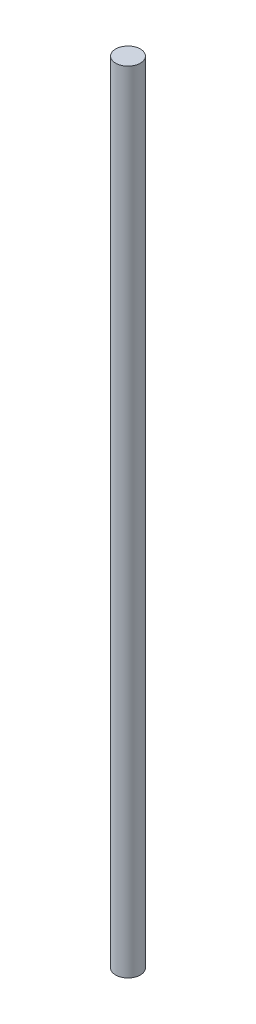
from build123d import *

# Parameters (mm, degrees)
SKETCH_1_R      = 1
EXTRUDE_1_DEPTH = 64


with BuildPart() as part:
    # 草图1 → 凸台-拉伸1 (new body)
    with BuildSketch(Plane(origin=(0, 0, 0), x_dir=(1, 0, 0), z_dir=(0, 1, 0))):
        with Locations(Location((0, 0, 0), (0, 0, 270))):
            Circle(SKETCH_1_R)
    extrude(amount=EXTRUDE_1_DEPTH)


solid = part.part
